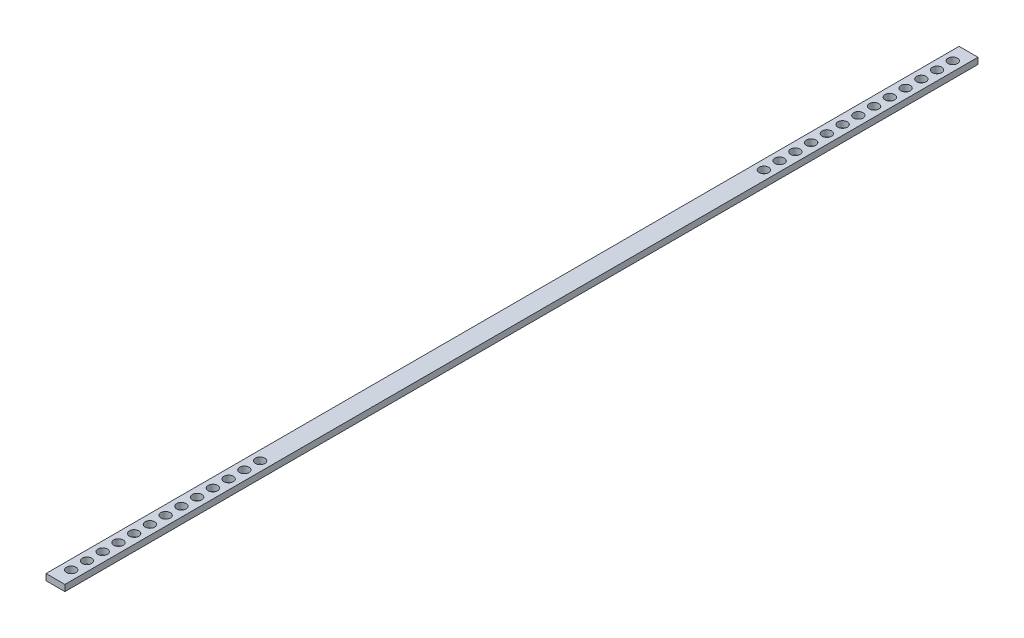
from build123d import *

# Parameters (mm, degrees)
SKIZZE1_W                       = 12
SKIZZE1_H                       = 4
AUFSATZ_LINEAR_AUSTRAGEN1_DEPTH = 580
SKIZZE2_R                       = 3
SCHNITT_LINEAR_AUSTRAGEN1_DEPTH = 581.137914638


with BuildPart() as part:
    # Skizze1 → Aufsatz-Linear austragen1 (new body)
    with BuildSketch(Plane.XY):
        with Locations((6, 2)):
            Rectangle(SKIZZE1_W, SKIZZE1_H)
    extrude(amount=AUFSATZ_LINEAR_AUSTRAGEN1_DEPTH)

    # Skizze2 → Schnitt-Linear austragen1 (cut, through all)
    with BuildSketch(Plane(origin=(0, 4, 0), x_dir=(1, 0, 0), z_dir=(0, 1, 0))):
        with Locations(Location((6, -10, 0), (0, 0, 270))):
            Circle(SKIZZE2_R)
        with Locations(Location((6, -20, 0), (0, 0, 270))):
            Circle(SKIZZE2_R)
        with Locations(Location((6, -30, 0), (0, 0, 270))):
            Circle(SKIZZE2_R)
        with Locations(Location((6, -40, 0), (0, 0, 270))):
            Circle(SKIZZE2_R)
        with Locations(Location((6, -50, 0), (0, 0, 270))):
            Circle(SKIZZE2_R)
        with Locations(Location((6, -60, 0), (0, 0, 270))):
            Circle(SKIZZE2_R)
        with Locations(Location((6, -70, 0), (0, 0, 270))):
            Circle(SKIZZE2_R)
        with Locations(Location((6, -80, 0), (0, 0, 270))):
            Circle(SKIZZE2_R)
        with Locations(Location((6, -90, 0), (0, 0, 270))):
            Circle(SKIZZE2_R)
        with Locations(Location((6, -100, 0), (0, 0, 270))):
            Circle(SKIZZE2_R)
        with Locations(Location((6, -110, 0), (0, 0, 270))):
            Circle(SKIZZE2_R)
        with Locations(Location((6, -120, 0), (0, 0, 270))):
            Circle(SKIZZE2_R)
        with Locations(Location((6, -130, 0), (0, 0, 270))):
            Circle(SKIZZE2_R)
        with Locations(Location((6, -450, 0), (0, 0, 90))):
            Circle(SKIZZE2_R)
        with Locations(Location((6, -460, 0), (0, 0, 90))):
            Circle(SKIZZE2_R)
        with Locations(Location((6, -470, 0), (0, 0, 90))):
            Circle(SKIZZE2_R)
        with Locations(Location((6, -480, 0), (0, 0, 90))):
            Circle(SKIZZE2_R)
        with Locations(Location((6, -490, 0), (0, 0, 90))):
            Circle(SKIZZE2_R)
        with Locations(Location((6, -500, 0), (0, 0, 90))):
            Circle(SKIZZE2_R)
        with Locations(Location((6, -510, 0), (0, 0, 90))):
            Circle(SKIZZE2_R)
        with Locations(Location((6, -520, 0), (0, 0, 90))):
            Circle(SKIZZE2_R)
        with Locations(Location((6, -530, 0), (0, 0, 90))):
            Circle(SKIZZE2_R)
        with Locations(Location((6, -540, 0), (0, 0, 90))):
            Circle(SKIZZE2_R)
        with Locations(Location((6, -550, 0), (0, 0, 90))):
            Circle(SKIZZE2_R)
        with Locations(Location((6, -560, 0), (0, 0, 90))):
            Circle(SKIZZE2_R)
        with Locations(Location((6, -570, 0), (0, 0, 90))):
            Circle(SKIZZE2_R)
    extrude(amount=-SCHNITT_LINEAR_AUSTRAGEN1_DEPTH, mode=Mode.SUBTRACT)


solid = part.part
